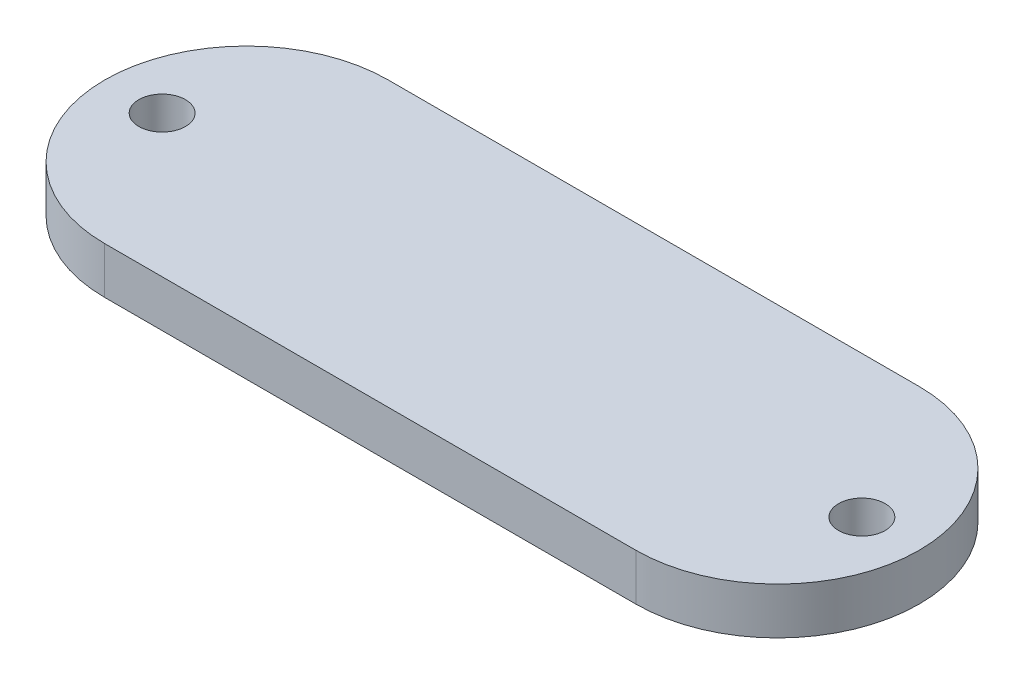
from build123d import *

# Parameters (mm, degrees)
SKETCH1_R           = 3.25
BOSS_EXTRUDE1_DEPTH = 6.5


with BuildPart() as part:
    # Sketch1 → Boss-Extrude1 (new body)
    with BuildSketch(Plane(origin=(0, 0, 0), x_dir=(1, 0, 0), z_dir=(0, 1, 0))):
        with BuildLine():
            Line((0, 19.75), (37, 19.75))
            ThreePointArc((37, 19.75), (56.75, 0), (37, -19.75))
            Line((37, -19.75), (0, -19.75))
            Line((0, -19.75), (-37, -19.75))
            ThreePointArc((-37, -19.75), (-56.75, 0), (-37, 19.75))
            Line((-37, 19.75), (0, 19.75))
        make_face()
        with Locations(Location((-48.75, 0, 0), (0, 0, 90))):
            Circle(SKETCH1_R, mode=Mode.SUBTRACT)
        with Locations(Location((48.75, 0, 0), (0, 0, 90))):
            Circle(SKETCH1_R, mode=Mode.SUBTRACT)
    extrude(amount=BOSS_EXTRUDE1_DEPTH)


solid = part.part
